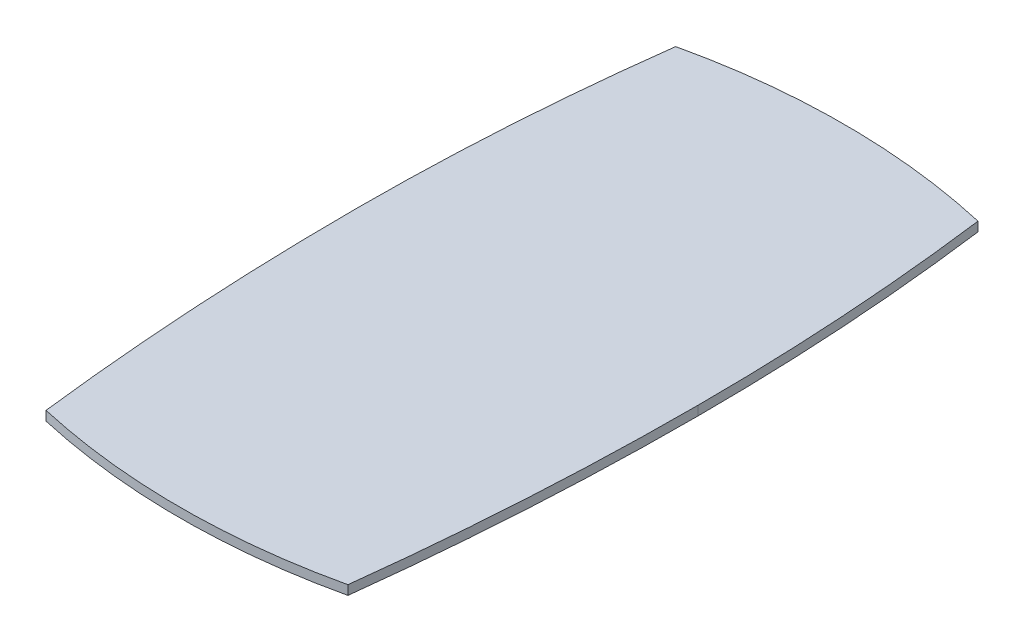
from build123d import *

# Parameters (mm, degrees)
BOSS_EXTRUDE1_DEPTH   = 1.5
SKETCH2_W             = 23.5
SKETCH2_H             = 6.5
BOSS_EXTRUDE2_DEPTH   = 2
BOSS_EXTRUDE2_2_DEPTH = 2
BOSS_EXTRUDE3_DEPTH   = 5.5
BOSS_EXTRUDE4_START   = -23.5
BOSS_EXTRUDE4_DEPTH   = 5.5


with BuildPart() as part:
    # Sketch1 → Boss-Extrude1 (new body)
    with BuildSketch(Plane(origin=(0, 0, 0), x_dir=(1, 0, 0), z_dir=(0, 1, 0))):
        with BuildLine():
            ThreePointArc((27.5, 107), (15.239653237, 106.313263521), (3.132689406, 104.261645493))
            ThreePointArc((3.132689406, 104.261645493), (0.783995568, 80.18160545), (0, 56))
            ThreePointArc((0, 56), (0.792144846, 29.318418419), (3.165788975, 2.730825397))
            ThreePointArc((3.165788975, 2.730825397), (15.25651976, 0.68484237), (27.5, 0))
            ThreePointArc((27.5, 0), (39.74348024, 0.68484237), (51.834211025, 2.730825397))
            ThreePointArc((51.834211025, 2.730825397), (54.207855154, 29.318418419), (55, 56))
            ThreePointArc((55, 56), (54.216004432, 80.18160545), (51.867310594, 104.261645493))
            ThreePointArc((51.867310594, 104.261645493), (39.760346763, 106.313263521), (27.5, 107))
        make_face()
    extrude(amount=BOSS_EXTRUDE1_DEPTH)


with BuildPart() as body_2:
    # Sketch2 → Boss-Extrude2 (new body)
    with BuildSketch(Plane.XZ):
        with Locations((27.5, -79.75)):
            Rectangle(SKETCH2_W, SKETCH2_H)
    extrude(amount=BOSS_EXTRUDE2_DEPTH)


with BuildPart() as body_3:
    # Sketch2 → Boss-Extrude2 2 (new body)
    with BuildSketch(Plane.XZ):
        with Locations((27.5, -92.75)):
            Rectangle(SKETCH2_W, SKETCH2_H)
    extrude(amount=BOSS_EXTRUDE2_2_DEPTH)


with BuildPart() as body_4:
    # Sketch3 → Boss-Extrude3 (new body)
    with BuildSketch(Plane(origin=(39.25, 0, 0), x_dir=(0, 0, -1), z_dir=(1, 0, 0))):
        with BuildLine():
            Line((82.52504112, -9.65625), (83, -9.5))
            ThreePointArc((83, -9.5), (82.399013115, -5.75), (83, -2))
            Line((83, -2), (82.474773097, -2))
            ThreePointArc((82.474773097, -2), (82.399234757, -2.249240176), (82.328905411, -2.5))
            ThreePointArc((82.328905411, -2.5), (81.903705329, -6.092466524), (82.52504112, -9.65625))
        make_face()
        with BuildLine():
            Line((77.171094589, -2.5), (82.328905411, -2.5))
            ThreePointArc((82.328905411, -2.5), (82.399234757, -2.249240176), (82.474773097, -2))
            Line((82.474773097, -2), (77.025226903, -2))
            ThreePointArc((77.025226903, -2), (77.100765243, -2.249240176), (77.171094589, -2.5))
        make_face()
        with BuildLine():
            ThreePointArc((76.97495888, -9.65625), (77.596294671, -6.092466524), (77.171094589, -2.5))
            ThreePointArc((77.171094589, -2.5), (77.100765243, -2.249240176), (77.025226903, -2))
            Line((77.025226903, -2), (76.5, -2))
            ThreePointArc((76.5, -2), (77.100986885, -5.75), (76.5, -9.5))
            Line((76.5, -9.5), (76.97495888, -9.65625))
        make_face()
        with BuildLine():
            Line((95.52504112, -9.65625), (96, -9.5))
            ThreePointArc((96, -9.5), (95.399013115, -5.75), (96, -2))
            Line((96, -2), (95.5, -2))
            ThreePointArc((95.5, -2), (95.420046877, -2.249157942), (95.345545576, -2.5))
            ThreePointArc((95.345545576, -2.5), (94.88924031, -6.091821292), (95.52504112, -9.65625))
        make_face()
        with BuildLine():
            Line((90.154456431, -2.5), (95.345545576, -2.5))
            ThreePointArc((95.345545576, -2.5), (95.420046877, -2.249157942), (95.5, -2))
            Line((95.5, -2), (90, -2))
            ThreePointArc((90, -2), (90.07995413, -2.24915793), (90.154456431, -2.5))
        make_face()
        with BuildLine():
            ThreePointArc((89.973280581, -9.661262184), (90.610708118, -6.094465822), (90.154456431, -2.5))
            ThreePointArc((90.154456431, -2.5), (90.07995413, -2.24915793), (90, -2))
            Line((90, -2), (89.5, -2))
            ThreePointArc((89.5, -2), (90.100986885, -5.75), (89.5, -9.5))
            Line((89.5, -9.5), (89.973280581, -9.661262184))
        make_face()
    extrude(amount=-BOSS_EXTRUDE3_DEPTH)


with BuildPart() as body_5:
    # Sketch3<3> → Boss-Extrude4 (new body)
    with BuildSketch(Plane(origin=(39.25, 0, 0), x_dir=(0, 0, -1), z_dir=(1, 0, 0)).offset(BOSS_EXTRUDE4_START)):
        with BuildLine():
            Line((82.52504112, -9.65625), (83, -9.5))
            ThreePointArc((83, -9.5), (82.399013115, -5.75), (83, -2))
            Line((83, -2), (82.474773097, -2))
            ThreePointArc((82.474773097, -2), (82.399234757, -2.249240176), (82.328905411, -2.5))
            ThreePointArc((82.328905411, -2.5), (81.903705329, -6.092466524), (82.52504112, -9.65625))
        make_face()
        with BuildLine():
            Line((77.171094589, -2.5), (82.328905411, -2.5))
            ThreePointArc((82.328905411, -2.5), (82.399234757, -2.249240176), (82.474773097, -2))
            Line((82.474773097, -2), (77.025226903, -2))
            ThreePointArc((77.025226903, -2), (77.100765243, -2.249240176), (77.171094589, -2.5))
        make_face()
        with BuildLine():
            ThreePointArc((76.97495888, -9.65625), (77.596294671, -6.092466524), (77.171094589, -2.5))
            ThreePointArc((77.171094589, -2.5), (77.100765243, -2.249240176), (77.025226903, -2))
            Line((77.025226903, -2), (76.5, -2))
            ThreePointArc((76.5, -2), (77.100986885, -5.75), (76.5, -9.5))
            Line((76.5, -9.5), (76.97495888, -9.65625))
        make_face()
        with BuildLine():
            ThreePointArc((90, -2), (90.614473663, -5.832820724), (89.973280581, -9.661262184))
            Line((89.973280581, -9.661262184), (89.5, -9.5))
            ThreePointArc((89.5, -9.5), (90.100986885, -5.75), (89.5, -2))
            Line((89.5, -2), (90, -2))
        make_face()
        with BuildLine():
            Line((90.154456431, -2.5), (95.345545576, -2.5))
            ThreePointArc((95.345545576, -2.5), (95.420046877, -2.249157942), (95.5, -2))
            Line((95.5, -2), (90, -2))
            ThreePointArc((90, -2), (90.07995413, -2.24915793), (90.154456431, -2.5))
        make_face()
        with BuildLine():
            Line((96, -2), (95.5, -2))
            ThreePointArc((95.5, -2), (94.885531529, -5.830175679), (95.52504112, -9.65625))
            Line((95.52504112, -9.65625), (96, -9.5))
            ThreePointArc((96, -9.5), (95.399013115, -5.75), (96, -2))
        make_face()
    extrude(amount=BOSS_EXTRUDE4_DEPTH)


solid = Compound([part.part, body_2.part, body_3.part, body_4.part, body_5.part])
